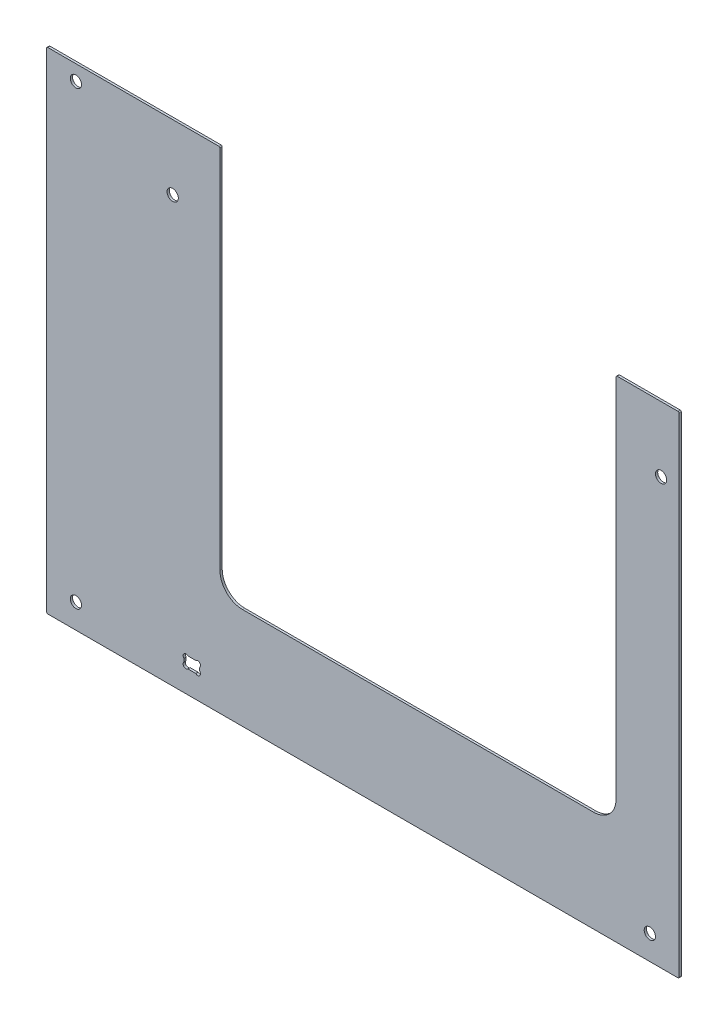
from build123d import *

# Parameters (mm, degrees)
SKETCH1_R                     = 2.5
SKETCH1_W                     = 7
SKETCH1_H                     = 5
F_1MM_STAINLESS_STEAL_DEPTH   = 1
SKETCH3_R                     = 1.25
CUT_EXTRUDE2_DEPTH            = 356.648703077
FILLET2_1MM_STAINLESS_STEAL_R = 0.5


with BuildPart() as part:
    # Sketch1 → 1mm Stainless_Steal (new body)
    with BuildSketch(Plane.XY):
        with BuildLine():
            Line((77, 218), (77, 55))
            ThreePointArc((77, 55), (79.928932188, 47.928932188), (87, 45))
            Line((87, 45), (243, 45))
            ThreePointArc((243, 45), (250.071067812, 47.928932188), (253, 55))
            Line((253, 55), (253, 218))
            Line((253, 218), (281, 218))
            Line((281, 218), (281, 0))
            Line((281, 0), (0, 0))
            Line((0, 0), (0, 218))
            Line((0, 218), (77, 218))
        make_face()
        with Locations((13, 10.85)):
            Circle(SKETCH1_R, mode=Mode.SUBTRACT)
        with Locations((13, 211.15)):
            Circle(SKETCH1_R, mode=Mode.SUBTRACT)
        with Locations((56, 189)):
            Circle(SKETCH1_R, mode=Mode.SUBTRACT)
        with Locations((268, 10.85)):
            Circle(SKETCH1_R, mode=Mode.SUBTRACT)
        with Locations((273, 189)):
            Circle(SKETCH1_R, mode=Mode.SUBTRACT)
        with Locations((64.5, 12.5)):
            Rectangle(SKETCH1_W, SKETCH1_H, mode=Mode.SUBTRACT)
    extrude(amount=F_1MM_STAINLESS_STEAL_DEPTH)

    # Sketch3 → Cut-Extrude2 (cut, through all)
    with BuildSketch(Plane.XY.offset(1)):
        with Locations((61.883883476, 14.116116524)):
            Circle(SKETCH3_R)
        with Locations((67.116116524, 10.883883476)):
            Circle(SKETCH3_R)
        with Locations((67.116116524, 14.116116524)):
            Circle(SKETCH3_R)
        with Locations((61.883883476, 10.883883476)):
            Circle(SKETCH3_R)
    extrude(amount=-CUT_EXTRUDE2_DEPTH, mode=Mode.SUBTRACT)

    # Fillet2_1mm_Stainless_Steal
    fillet2_1mm_stainless_steal_edges = [part.edges().sort_by_distance(p)[0] for p in [
        (253, 218, 0.5),
        (281, 218, 0.5),
        (281, 0, 0.5),
        (0, 0, 0.5),
        (0, 218, 0.5),
        (77, 218, 0.5),
    ]]
    fillet(fillet2_1mm_stainless_steal_edges, radius=FILLET2_1MM_STAINLESS_STEAL_R)


solid = part.part
